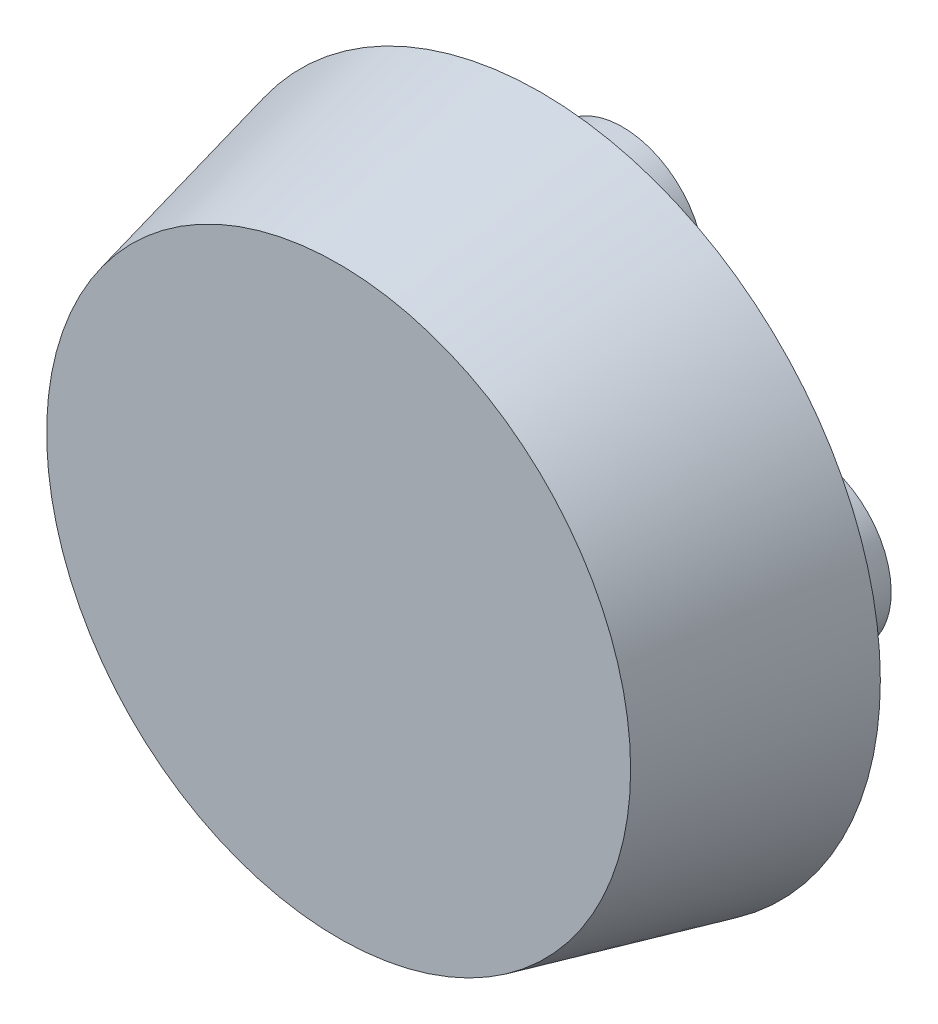
from build123d import *

# Parameters (mm, degrees)
CABLE_SKETCH_R      = 35
CABLE_EXTRUDE_DEPTH = 35
CABLE_PATTERN_COUNT = 4


with BuildPart() as part:
    # Big Plug Sketch → Big Plug (revolve)
    with BuildSketch(Plane(origin=(0, 0, 0), x_dir=(0, 0, -1), z_dir=(1, 0, 0))):
        with BuildLine():
            Line((531.601551916, 125), (531.601551916, 0))
            Line((531.601551916, 0), (635, 0))
            ThreePointArc((635, 0), (630.771254316, 73.161634266), (618.141339438, 145.348837209))
            Line((618.141339438, 145.348837209), (531.601551916, 125))
        make_face()
    revolve(axis=Axis((0, 0, 0), (0, 0, -1)))

    # Cable Sketch → Cable Extrude (add)
    with BuildSketch(Plane.XY.offset(-618.141339438)):
        with Locations((0, 80)):
            Circle(CABLE_SKETCH_R)
    cable_extrude = extrude(amount=-CABLE_EXTRUDE_DEPTH)

    # Cable Pattern: Cable Extrude ×4 about axis
    cable_pattern_axis = Axis((0, 0, 0), (0, 0, 1))
    for i in range(1, CABLE_PATTERN_COUNT):
        add(cable_extrude.rotate(cable_pattern_axis, i * 360 / CABLE_PATTERN_COUNT))


solid = part.part
